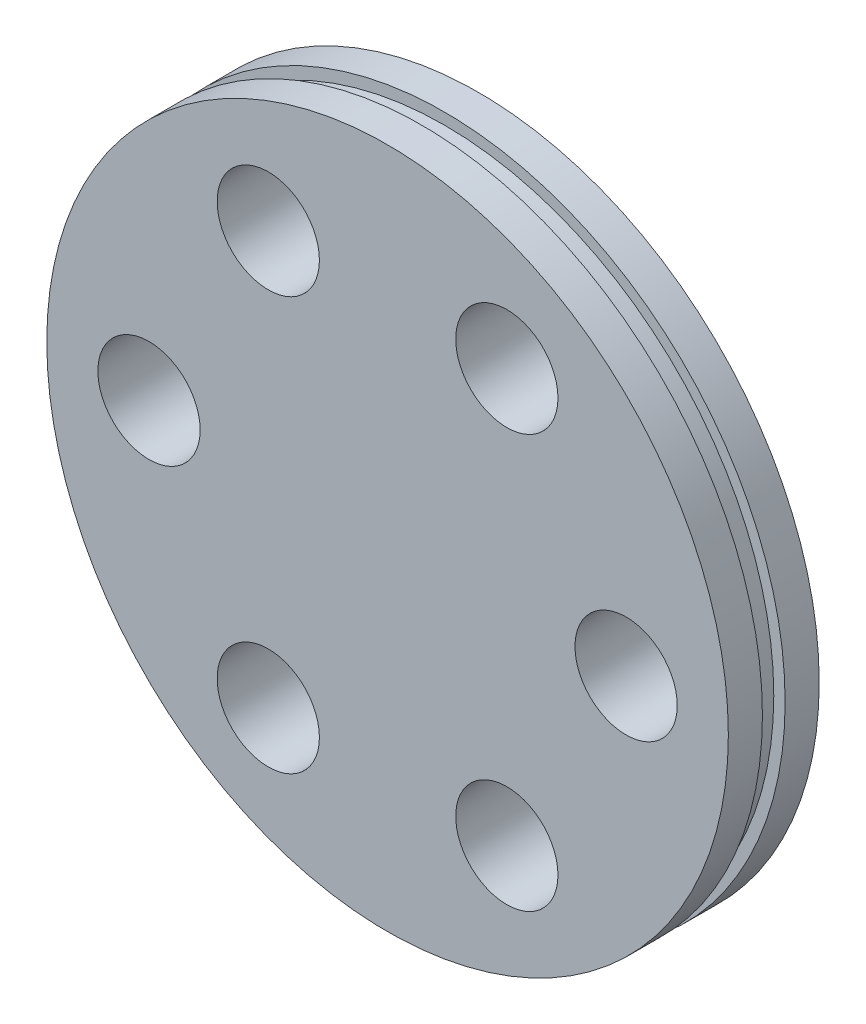
from build123d import *

# Parameters (mm, degrees)
ESQUISSE1_R                  = 30
ESQUISSE1_R_2                = 11
BOSS_EXTRU_1_DEPTH           = 6
ESQUISSE2_R                  = 30
BOSS_EXTRU_2_DEPTH           = 2
ENL_V_MAT_EXTRU_1_DEPTH      = 1
ENL_V_MAT_EXTRU_1_DEPTH_BACK = 1
ESQUISSE3_R                  = 30
ESQUISSE3_R_2                = 29
ESQUISSE4_R                  = 4.5
AJOURAGE_DEPTH               = 44.17406629


with BuildPart() as part:
    # Esquisse1 → Boss.-Extru.1 (new body)
    with BuildSketch(Plane.XY):
        Circle(ESQUISSE1_R)
        Circle(ESQUISSE1_R_2, mode=Mode.SUBTRACT)
    extrude(amount=BOSS_EXTRU_1_DEPTH)

    # Esquisse2 → Boss.-Extru.2 (add)
    with BuildSketch(Plane.XY.offset(6)):
        Circle(ESQUISSE2_R)
    extrude(amount=BOSS_EXTRU_2_DEPTH)

    # Esquisse3 → Enlèv. mat.-Extru.1 (cut, two sides: drawn at the far end of the back side and taken through both)
    with BuildSketch(Plane.XY.offset(4).offset(-ENL_V_MAT_EXTRU_1_DEPTH_BACK)):
        Circle(ESQUISSE3_R)
        Circle(ESQUISSE3_R_2, mode=Mode.SUBTRACT)
    extrude(amount=ENL_V_MAT_EXTRU_1_DEPTH + ENL_V_MAT_EXTRU_1_DEPTH_BACK, mode=Mode.SUBTRACT)

    # Esquisse4 → Ajourage (cut, through all)
    with BuildSketch(Plane.XY.offset(8)):
        with Locations((21, 0)):
            Circle(ESQUISSE4_R)
        with Locations((10.5, 18.186533479)):
            Circle(ESQUISSE4_R)
        with Locations((-10.5, 18.186533479)):
            Circle(ESQUISSE4_R)
        with Locations((-21, 0)):
            Circle(ESQUISSE4_R)
        with Locations((-10.5, -18.186533479)):
            Circle(ESQUISSE4_R)
        with Locations((10.5, -18.186533479)):
            Circle(ESQUISSE4_R)
    extrude(amount=-AJOURAGE_DEPTH, mode=Mode.SUBTRACT)


solid = part.part
